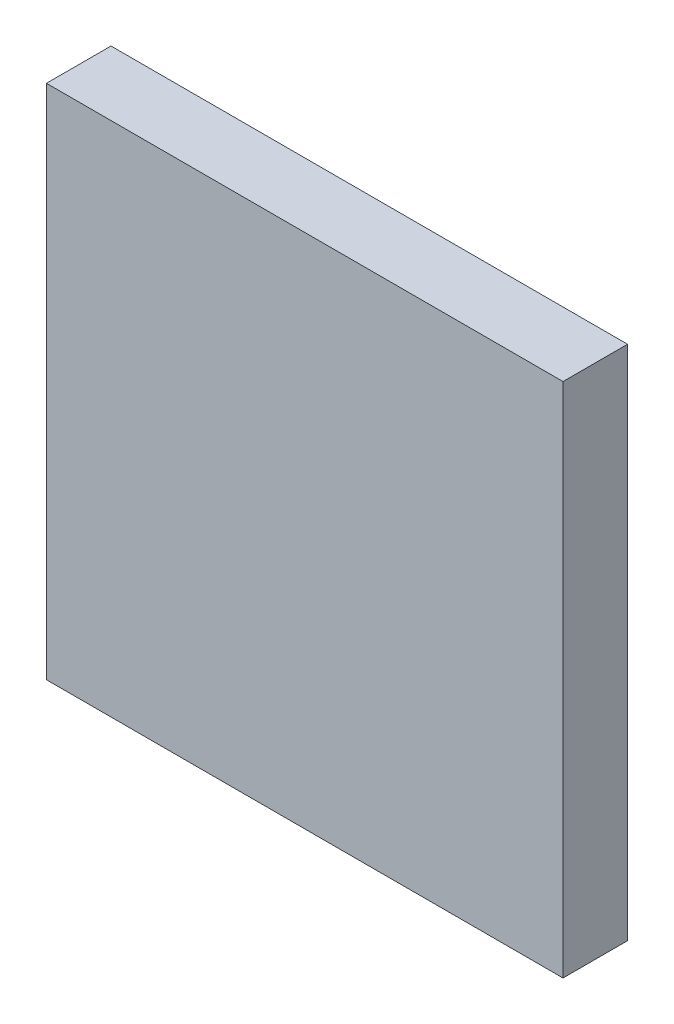
from build123d import *

# Parameters (mm, degrees)
CROQUIS1_W              = 400
CROQUIS1_H              = 400
SALIENTE_EXTRUIR1_DEPTH = 50


with BuildPart() as part:
    # Croquis1 → Saliente-Extruir1 (new body)
    with BuildSketch(Plane(origin=(0, 0, 0), x_dir=(0, 1, 0), z_dir=(0, 0, 1))):
        Rectangle(CROQUIS1_W, CROQUIS1_H)
    extrude(amount=SALIENTE_EXTRUIR1_DEPTH)


solid = part.part
